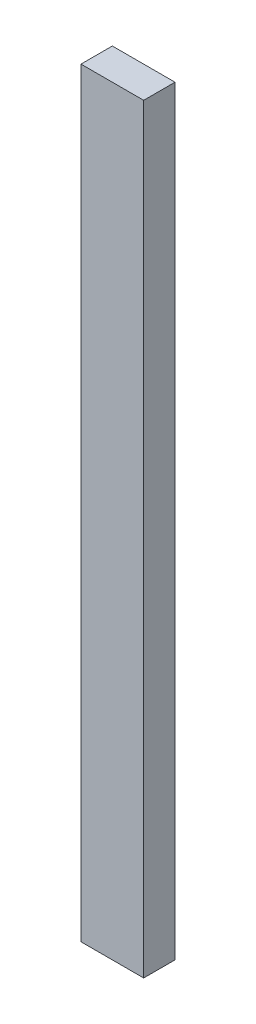
from build123d import *

# Parameters (mm, degrees)
ESQUISSE1_W        = 48
ESQUISSE1_H        = 582
BOSS_EXTRU_1_DEPTH = 12


with BuildPart() as part:
    # Esquisse1 → Boss.-Extru.1 (new, symmetric)
    with BuildSketch(Plane.XY):
        Rectangle(ESQUISSE1_W, ESQUISSE1_H)
    extrude(amount=BOSS_EXTRU_1_DEPTH, both=True)


solid = part.part
